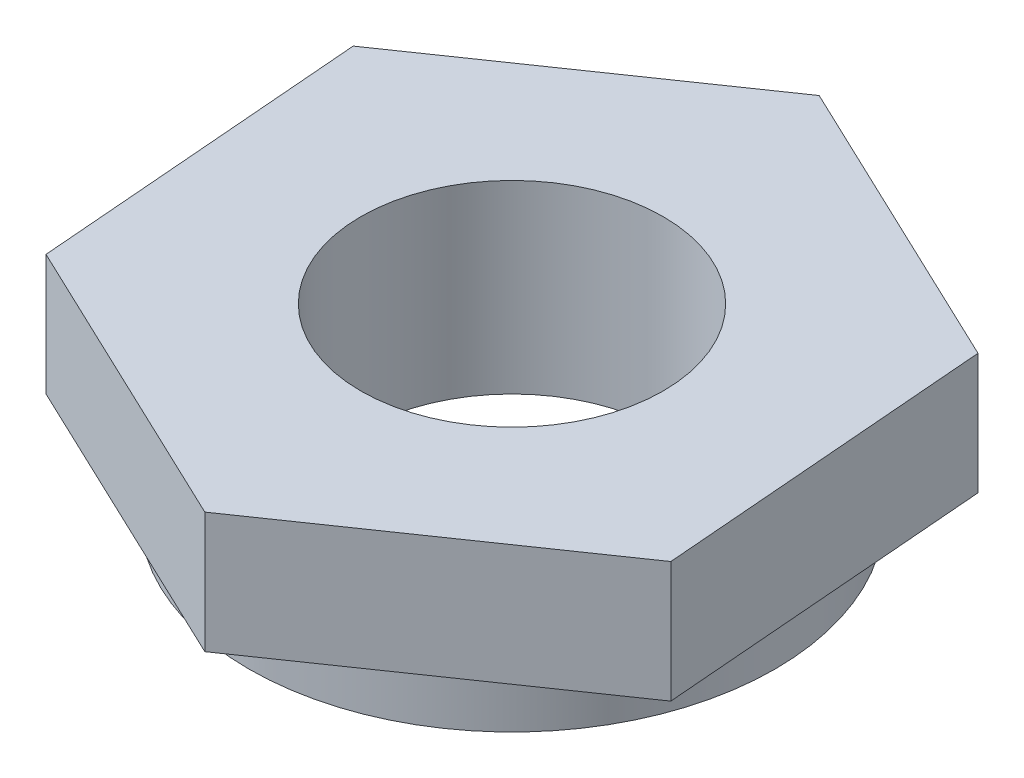
from build123d import *

# Parameters (mm, degrees)
EXTRUDE_1_DEPTH     = 1
SKETCH_2_R          = 2.175
EXTRUDE_2_DEPTH     = 0.53
SKETCH_3_R          = 1.25
CUT_EXTRUDE_1_DEPTH = 5.029563181


with BuildPart() as part:
    # 草图1 → 凸台-拉伸1 (new body)
    with BuildSketch(Plane(origin=(0, 0, 0), x_dir=(1, 0, 0), z_dir=(0, 1, 0))):
        Polygon((2.503115377, -1.189291137), (2.281514026, 1.573115937), (-0.221601352, 2.762407074), (-2.503115377, 1.189291137), (-2.281514026, -1.573115937), (0.221601352, -2.762407074), align=None)
    extrude(amount=EXTRUDE_1_DEPTH)

    # 草图2 → 凸台-拉伸2 (add)
    with BuildSketch(Plane.XZ):
        with Locations(Location((0, 0, 0), (0, 0, 270))):
            Circle(SKETCH_2_R)
    extrude(amount=EXTRUDE_2_DEPTH)

    # 草图3 → 切除-拉伸1 (cut, through all)
    with BuildSketch(Plane(origin=(0, -0.53, 0), x_dir=(-1, 0, 0), z_dir=(0, -1, 0))):
        with Locations(Location((0, 0, 0), (0, 0, 90))):
            Circle(SKETCH_3_R)
    extrude(amount=-CUT_EXTRUDE_1_DEPTH, mode=Mode.SUBTRACT)


solid = part.part
